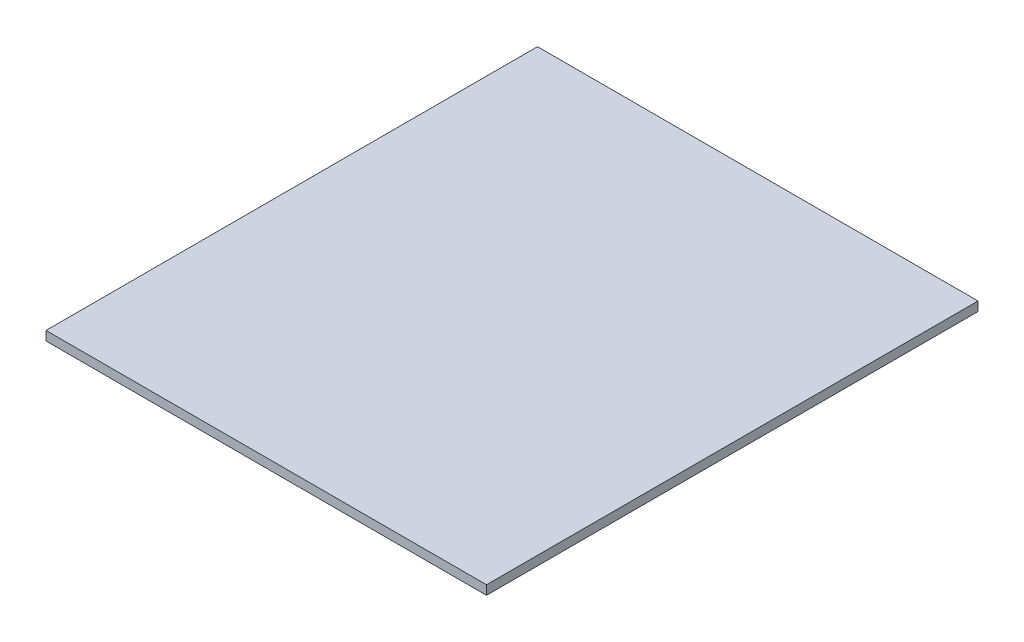
from build123d import *

# Parameters (mm, degrees)
SKETCH1_W           = 877.8875
SKETCH1_H           = 979.4875
BOSS_EXTRUDE1_DEPTH = 18.25625


with BuildPart() as part:
    # Sketch1 → Boss-Extrude1 (new body)
    with BuildSketch(Plane(origin=(0, 0, 0), x_dir=(1, 0, 0), z_dir=(0, 1, 0))):
        Rectangle(SKETCH1_W, SKETCH1_H)
    extrude(amount=BOSS_EXTRUDE1_DEPTH)


solid = part.part
